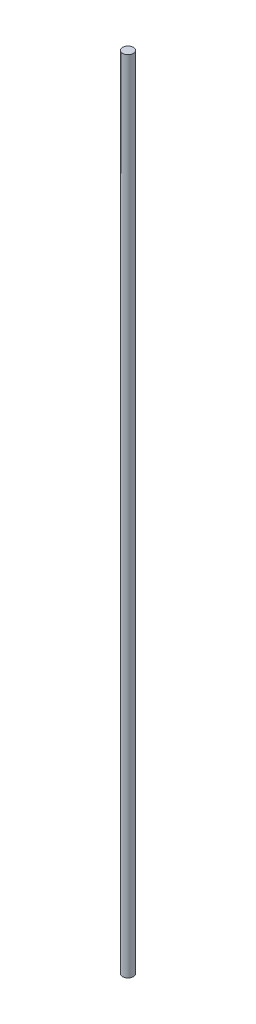
from build123d import *

# Parameters (mm, degrees)
SKETCH1_R           = 4
BOSS_EXTRUDE1_DEPTH = 300


with BuildPart() as part:
    # Sketch1 → Boss-Extrude1 (new, symmetric)
    with BuildSketch(Plane(origin=(0, 0, 0), x_dir=(1, 0, 0), z_dir=(0, 1, 0))):
        with Locations(Location((0, 0, 0), (0, 0, 270))):
            Circle(SKETCH1_R)
    extrude(amount=BOSS_EXTRUDE1_DEPTH, both=True)


solid = part.part
